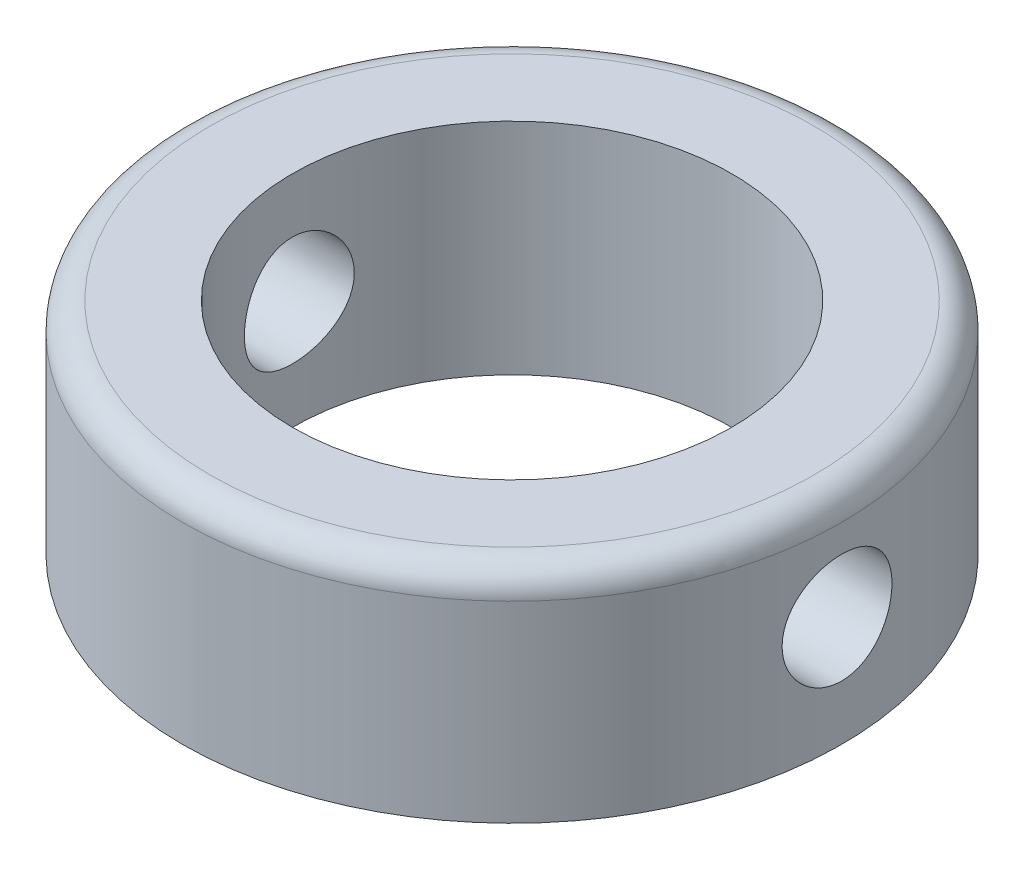
from build123d import *

# Parameters (mm, degrees)
SKETCH2_R               = 12
SKETCH2_R_2             = 8
BOSS_EXTRUDE1_DEPTH     = 8
FILLET1_R               = 1
CUT_EXTRUDE1_DEPTH      = 19.761663039
CUT_EXTRUDE1_DEPTH_BACK = 19.761663039
SKETCH3_R               = 2


with BuildPart() as part:
    # Sketch2 → Boss-Extrude1 (new body)
    with BuildSketch(Plane(origin=(0, 0, 0), x_dir=(1, 0, 0), z_dir=(0, 1, 0))):
        with Locations(Location((0, 0, 0), (0, 0, 270))):
            Circle(SKETCH2_R)
        with Locations(Location((0, 0, 0), (0, 0, 270))):
            Circle(SKETCH2_R_2, mode=Mode.SUBTRACT)
    extrude(amount=BOSS_EXTRUDE1_DEPTH)

    # Fillet1
    fillet1_edges = [part.edges().sort_by_distance(p)[0] for p in [
        (0, 8, -12),
    ]]
    fillet(fillet1_edges, radius=FILLET1_R)

    # Sketch3 → Cut-Extrude1 (cut, two sides: drawn at the far end of the back side and taken through both)
    with BuildSketch(Plane(origin=(0, 0, 0), x_dir=(0, 0, -1), z_dir=(1, 0, 0)).offset(-CUT_EXTRUDE1_DEPTH_BACK)):
        with Locations((0, 4)):
            Circle(SKETCH3_R)
    extrude(amount=CUT_EXTRUDE1_DEPTH + CUT_EXTRUDE1_DEPTH_BACK, mode=Mode.SUBTRACT)


solid = part.part
